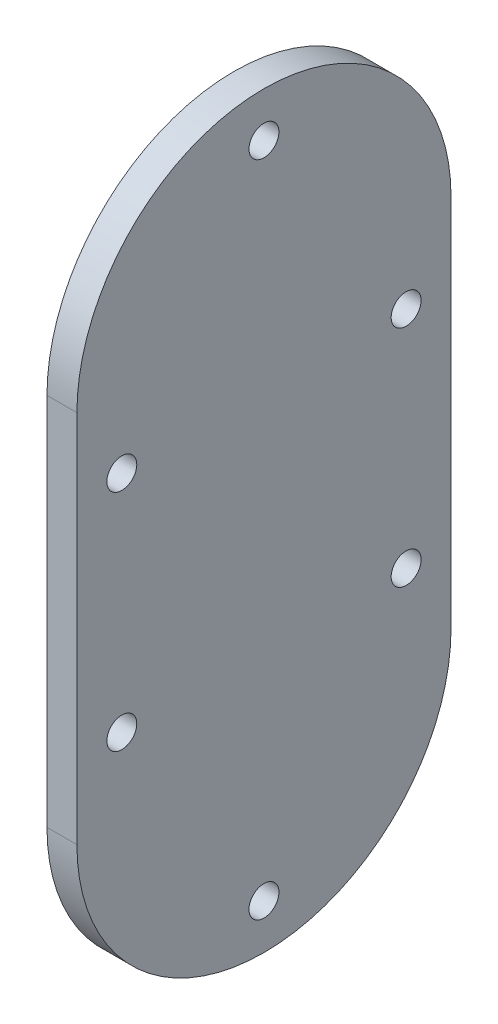
from build123d import *

# Parameters (mm, degrees)
SKETCH1_R           = 2
BOSS_EXTRUDE1_DEPTH = 4


with BuildPart() as part:
    # Sketch1 → Boss-Extrude1 (new body)
    with BuildSketch(Plane.YZ):
        with BuildLine():
            Line((0, 25), (50, 25))
            ThreePointArc((50, 25), (75, 0), (50, -25))
            Line((50, -25), (0, -25))
            ThreePointArc((0, -25), (-25, 0), (0, 25))
        make_face()
        with Locations(Location((10, 19, 0), (0, 0, 270))):
            Circle(SKETCH1_R, mode=Mode.SUBTRACT)
        with Locations(Location((40, 19, 0), (0, 0, 270))):
            Circle(SKETCH1_R, mode=Mode.SUBTRACT)
        with Locations(Location((69, 0, 0), (0, 0, 270))):
            Circle(SKETCH1_R, mode=Mode.SUBTRACT)
        with Locations(Location((-19, 0, 0), (0, 0, 270))):
            Circle(SKETCH1_R, mode=Mode.SUBTRACT)
        with Locations(Location((10, -19, 0), (0, 0, 270))):
            Circle(SKETCH1_R, mode=Mode.SUBTRACT)
        with Locations(Location((40, -19, 0), (0, 0, 270))):
            Circle(SKETCH1_R, mode=Mode.SUBTRACT)
    extrude(amount=BOSS_EXTRUDE1_DEPTH)


solid = part.part
